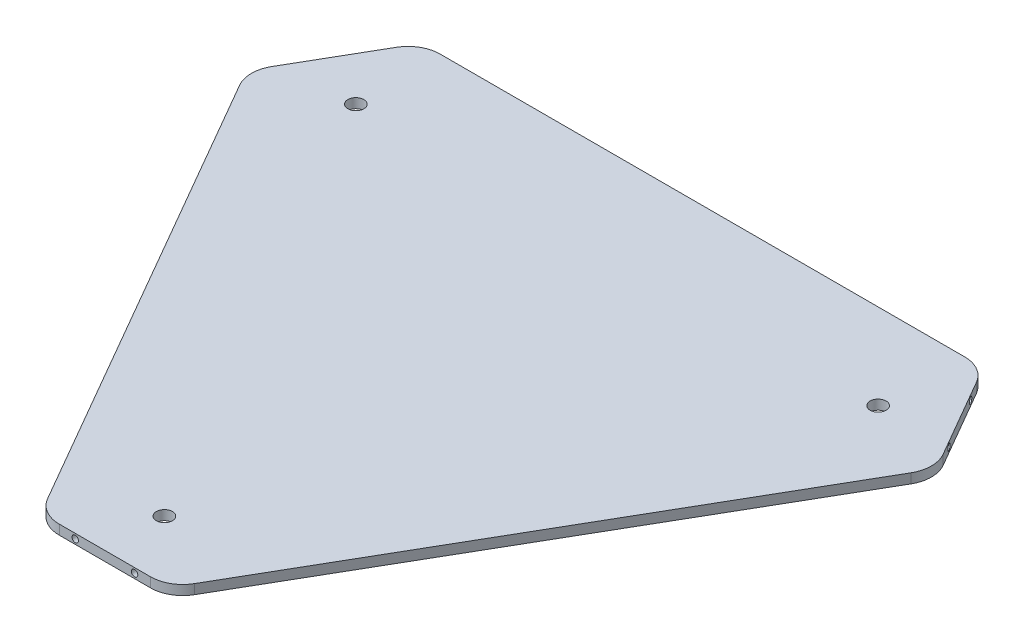
from build123d import *

# Parameters (mm, degrees)
SKETCH1_R           = 3.175
BOSS_EXTRUDE1_DEPTH = 3.81
CUT_EXTRUDE1_REACH  = 334.908
SKETCH3_R           = 1.27
CUT_EXTRUDE2_REACH  = 274.112
SKETCH5_R           = 1.27
CUT_EXTRUDE3_REACH  = 334.911
SKETCH6_R           = 1.27
BOSS_EXTRUDE2_DEPTH = 3.81


with BuildPart() as part:
    # Sketch1 → Boss-Extrude1 (new body)
    with BuildSketch(Plane(origin=(0, 0, 0), x_dir=(1, 0, 0), z_dir=(0, 1, 0))):
        with BuildLine():
            Line((-132.862230357, 80.626602679), (-114.818360917, 111.876376892))
            ThreePointArc((-114.818360917, 111.876376892), (-110.170255519, 116.524341207), (-103.82099168, 118.225900714))
            Line((-103.82099168, 118.225900714), (103.762977343, 118.240259528))
            ThreePointArc((103.762977343, 118.240259528), (110.109496385, 116.541297953), (114.757781541, 111.898214981))
            Line((114.757781541, 111.898214981), (132.857908371, 80.600189632))
            ThreePointArc((132.857908371, 80.600189632), (134.563982049, 74.246129937), (132.86180691, 67.891024761))
            Line((132.86180691, 67.891024761), (29.0379736, -111.891469007))
            ThreePointArc((29.0379736, -111.891469007), (24.389544583, -116.539131318), (18.040149336, -118.240259558))
            Line((18.040149336, -118.240259558), (-18.094408415, -118.240259558))
            ThreePointArc((-18.094408415, -118.240259558), (-24.445497205, -116.538153501), (-29.09418809, -111.888081791))
            Line((-29.09418809, -111.888081791), (-132.863762321, 67.928304298))
            ThreePointArc((-132.863762321, 67.928304298), (-134.563982554, 74.277658701), (-132.862230357, 80.626602679))
        make_face()
        with Locations(Location((-103.330851621, 84.381028983, 0), (0, 0, 90))):
            Circle(SKETCH1_R, mode=Mode.SUBTRACT)
        with Locations(Location((-0.028433279, -94.702561062, 0), (0, 0, 90))):
            Circle(SKETCH1_R, mode=Mode.SUBTRACT)
        with Locations(Location((103.336854698, 84.397127461, 0), (0, 0, 90))):
            Circle(SKETCH1_R, mode=Mode.SUBTRACT)
        with BuildLine():
            Line((-84.013266269, 67.022348434), (-78.642736989, 76.323448067))
            ThreePointArc((-78.642736989, 76.323448067), (-73.995553024, 80.970880326), (-67.647495776, 82.672971564))
            Line((-67.647495776, 82.672971564), (67.773359352, 82.705030032))
            ThreePointArc((67.773359352, 82.705030032), (74.121084724, 81.006600385), (78.770291575, 76.36298581))
            Line((78.770291575, 76.36298581), (84.141622987, 67.075091406))
            ThreePointArc((84.141622987, 67.075091406), (85.847697169, 60.718674744), (84.143163353, 54.361844845))
            Line((84.143163353, 54.361844845), (16.352129804, -62.925309178))
            ThreePointArc((16.352129804, -62.925309178), (11.704017593, -67.570067982), (5.356663713, -69.27001804))
            Line((5.356663713, -69.27001804), (-5.379766134, -69.27001804))
            ThreePointArc((-5.379766134, -69.27001804), (-11.731679612, -67.567435699), (-16.380497701, -62.916190507))
            Line((-16.380497701, -62.916190507), (-84.015750126, 54.325699819))
            ThreePointArc((-84.015750126, 54.325699819), (-85.715018316, 60.674356799), (-84.013266269, 67.022348434))
        make_face(mode=Mode.SUBTRACT)
    extrude(amount=BOSS_EXTRUDE1_DEPTH)

    # Sketch3 → Cut-Extrude1 (cut, up to next)
    with BuildSketch(Plane(origin=(134.490180652, 0, -77.777728789), x_dir=(-0.5006264112230908, 0, -0.8656634429071663), z_dir=(0.8656634429071663, 0, -0.5006264112230908)), mode=Mode.PRIVATE) as cut_extrude1_sk1:
        with Locations((9.583713099, 1.905)):
            Circle(SKETCH3_R)
    cut_extrude1_tool1 = extrude(cut_extrude1_sk1.sketch, amount=-CUT_EXTRUDE1_REACH, mode=Mode.PRIVATE) & part.part
    # Sketch3 → Cut-Extrude1 (cut, up to next)
    with BuildSketch(Plane(origin=(134.490180652, 0, -77.777728789), x_dir=(-0.5006264112230908, 0, -0.8656634429071663), z_dir=(0.8656634429071663, 0, -0.5006264112230908)), mode=Mode.PRIVATE) as cut_extrude1_sk2:
        with Locations((33.073860572, 1.905)):
            Circle(SKETCH3_R)
    cut_extrude1_tool2 = extrude(cut_extrude1_sk2.sketch, amount=-CUT_EXTRUDE1_REACH, mode=Mode.PRIVATE) & part.part
    add(cut_extrude1_tool1.solids().sort_by_distance((129.692321, 1.905, -86.073999))[0], mode=Mode.SUBTRACT)
    add(cut_extrude1_tool2.solids().sort_by_distance((117.932533, 1.905, -106.408561))[0], mode=Mode.SUBTRACT)

    # Sketch5 → Cut-Extrude2 (cut, up to next)
    with BuildSketch(Plane.XY.offset(118.240259558), mode=Mode.PRIVATE) as cut_extrude2_sk1:
        with Locations((-11.784935705, 1.905)):
            Circle(SKETCH5_R)
    cut_extrude2_tool1 = extrude(cut_extrude2_sk1.sketch, amount=-CUT_EXTRUDE2_REACH, mode=Mode.PRIVATE) & part.part
    # Sketch5 → Cut-Extrude2 (cut, up to next)
    with BuildSketch(Plane.XY.offset(118.240259558), mode=Mode.PRIVATE) as cut_extrude2_sk2:
        with Locations((11.705218914, 1.905)):
            Circle(SKETCH5_R)
    cut_extrude2_tool2 = extrude(cut_extrude2_sk2.sketch, amount=-CUT_EXTRUDE2_REACH, mode=Mode.PRIVATE) & part.part
    add(cut_extrude2_tool1.solids().sort_by_distance((-11.784936, 1.905, 118.24026))[0], mode=Mode.SUBTRACT)
    add(cut_extrude2_tool2.solids().sort_by_distance((11.705219, 1.905, 118.24026))[0], mode=Mode.SUBTRACT)

    # Sketch6 → Cut-Extrude3 (cut, up to next)
    with BuildSketch(Plane(origin=(-134.555779523, 0, -77.693582727), x_dir=(-0.500037491916206, 0, 0.8660037567344326), z_dir=(-0.8660037567344328, 0, -0.500037491916206)), mode=Mode.PRIVATE) as cut_extrude3_sk1:
        with Locations((-33.174438242, 1.905)):
            Circle(SKETCH6_R)
    cut_extrude3_tool1 = extrude(cut_extrude3_sk1.sketch, amount=-CUT_EXTRUDE3_REACH, mode=Mode.PRIVATE) & part.part
    # Sketch6 → Cut-Extrude3 (cut, up to next)
    with BuildSketch(Plane(origin=(-134.555779523, 0, -77.693582727), x_dir=(-0.500037491916206, 0, 0.8660037567344326), z_dir=(-0.8660037567344328, 0, -0.500037491916206)), mode=Mode.PRIVATE) as cut_extrude3_sk2:
        with Locations((-9.684283586, 1.905)):
            Circle(SKETCH6_R)
    cut_extrude3_tool2 = extrude(cut_extrude3_sk2.sketch, amount=-CUT_EXTRUDE3_REACH, mode=Mode.PRIVATE) & part.part
    add(cut_extrude3_tool1.solids().sort_by_distance((-117.967317, 1.905, -106.422771))[0], mode=Mode.SUBTRACT)
    add(cut_extrude3_tool2.solids().sort_by_distance((-129.713275, 1.905, -86.080209))[0], mode=Mode.SUBTRACT)

    # Sketch7 → Boss-Extrude2 (add)
    with BuildSketch(Plane(origin=(0, 0, 0), x_dir=(1, 0, 0), z_dir=(0, 1, 0))):
        with BuildLine():
            Line((84.141622987, 67.075091406), (78.770291575, 76.36298581))
            ThreePointArc((78.770291575, 76.36298581), (74.121084724, 81.006600385), (67.773359352, 82.705030032))
            Line((67.773359352, 82.705030032), (-67.647495776, 82.672971564))
            ThreePointArc((-67.647495776, 82.672971564), (-73.995553024, 80.970880326), (-78.642736989, 76.323448067))
            Line((-78.642736989, 76.323448067), (-84.013266269, 67.022348434))
            ThreePointArc((-84.013266269, 67.022348434), (-85.715018316, 60.674356799), (-84.015750126, 54.325699819))
            Line((-84.015750126, 54.325699819), (-16.380497701, -62.916190507))
            ThreePointArc((-16.380497701, -62.916190507), (-11.731679612, -67.567435699), (-5.379766134, -69.27001804))
            Line((-5.379766134, -69.27001804), (5.356663713, -69.27001804))
            ThreePointArc((5.356663713, -69.27001804), (11.704017593, -67.570067982), (16.352129804, -62.925309178))
            Line((16.352129804, -62.925309178), (84.143163353, 54.361844845))
            ThreePointArc((84.143163353, 54.361844845), (85.847697169, 60.718674744), (84.141622987, 67.075091406))
        make_face()
    extrude(amount=BOSS_EXTRUDE2_DEPTH)


solid = part.part
